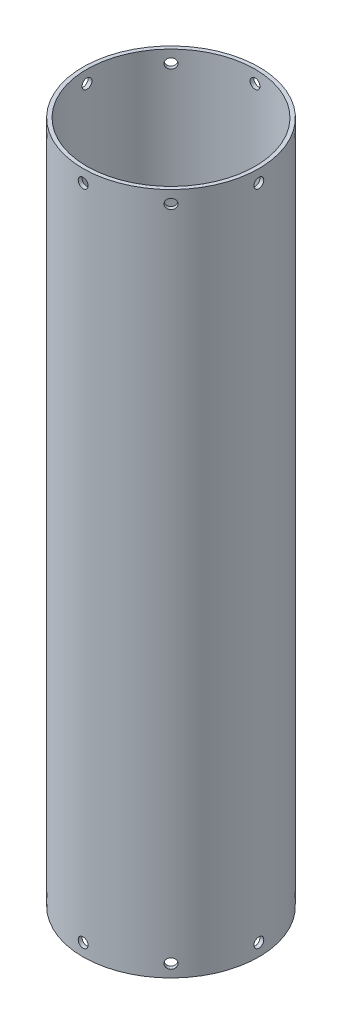
from build123d import *

# Parameters (mm, degrees)
SKETCH1_R                   = 89.2948303
SKETCH1_R_2                 = 85.4253943
BOSS_EXTRUDE1_DEPTH         = 693.1406
LOX_TOP_HOLES_REACH         = 681.577
LOX_TOP_HOLES_END_RADIUS    = 89.2948303
SKETCH2_R                   = 5.0165
CIRPATTERN1_COUNT           = 8
LOX_BOTTOM_HOLES_REACH      = 681.577
LOX_BOTTOM_HOLES_END_RADIUS = 89.2948303
SKETCH3_R                   = 5.0165
CIRPATTERN2_COUNT           = 8
SCALE1_SCALE                = 0.426676438


with BuildPart() as part:
    # Sketch1 → Boss-Extrude1 (new body)
    with BuildSketch(Plane(origin=(0, 0, 0), x_dir=(1, 0, 0), z_dir=(0, 1, 0))):
        with Locations(Location((0, 0, 0), (0, 0, 270))):
            Circle(SKETCH1_R)
        with Locations(Location((0, 0, 0), (0, 0, 270))):
            Circle(SKETCH1_R_2, mode=Mode.SUBTRACT)
    extrude(amount=BOSS_EXTRUDE1_DEPTH)

    # LOX Top Holes: up to this cylinder (the profile starts inside it)
    lox_top_holes_end = Plane(origin=(0, 680.4406, 0), z_dir=(0, -1, 0)) * Cylinder(LOX_TOP_HOLES_END_RADIUS, 1542.7436606, mode=Mode.PRIVATE)
    # Sketch2 → LOX Top Holes (cut, up to the surface)
    with BuildSketch(Plane(origin=(0, 667.7406, 0), x_dir=(0, 0, 1), z_dir=(1, 0, 0)), mode=Mode.PRIVATE) as lox_top_holes_sk1:
        with Locations((0, -12.7)):
            Circle(SKETCH2_R)
    lox_top_holes_tool1 = extrude(lox_top_holes_sk1.sketch, amount=LOX_TOP_HOLES_REACH, mode=Mode.PRIVATE) & lox_top_holes_end
    lox_top_holes = lox_top_holes_tool1.solids().sort_by_distance((0, 680.4406, 0))[0]
    add(lox_top_holes, mode=Mode.SUBTRACT)

    # CirPattern1: LOX Top Holes ×8 about axis
    cirpattern1_axis = Axis((0, 693.1406, 0), (0, 1, 0))
    for i in range(1, CIRPATTERN1_COUNT):
        add(lox_top_holes.rotate(cirpattern1_axis, i * 360 / CIRPATTERN1_COUNT), mode=Mode.SUBTRACT)

    # LOX Bottom Holes: up to this cylinder (the profile starts inside it)
    lox_bottom_holes_end = Plane(origin=(0, 12.7, 0), z_dir=(0, -1, 0)) * Cylinder(LOX_BOTTOM_HOLES_END_RADIUS, 1542.7436606, mode=Mode.PRIVATE)
    # Sketch3 → LOX Bottom Holes (cut, up to the surface)
    with BuildSketch(Plane(origin=(0, 25.4, 0), x_dir=(0, 0, -1), z_dir=(1, 0, 0)), mode=Mode.PRIVATE) as lox_bottom_holes_sk1:
        with Locations(Location((0, -12.7, 0), (0, 0, 180))):
            Circle(SKETCH3_R)
    lox_bottom_holes_tool1 = extrude(lox_bottom_holes_sk1.sketch, amount=LOX_BOTTOM_HOLES_REACH, mode=Mode.PRIVATE) & lox_bottom_holes_end
    lox_bottom_holes = lox_bottom_holes_tool1.solids().sort_by_distance((0, 12.7, 0))[0]
    add(lox_bottom_holes, mode=Mode.SUBTRACT)

    # CirPattern2: LOX Bottom Holes ×8 about axis
    cirpattern2_axis = Axis((0, 0, 0), (0, 1, 0))
    for i in range(1, CIRPATTERN2_COUNT):
        add(lox_bottom_holes.rotate(cirpattern2_axis, i * 360 / CIRPATTERN2_COUNT), mode=Mode.SUBTRACT)


with BuildPart() as part_1:
    # Scale1: scaled about (0.001181171, 346.570295931, -0.000247719)
    add(part.part.scale(SCALE1_SCALE).moved(Location((0.000677193, 198.696916443, -0.000142023))))


solid = part_1.part
